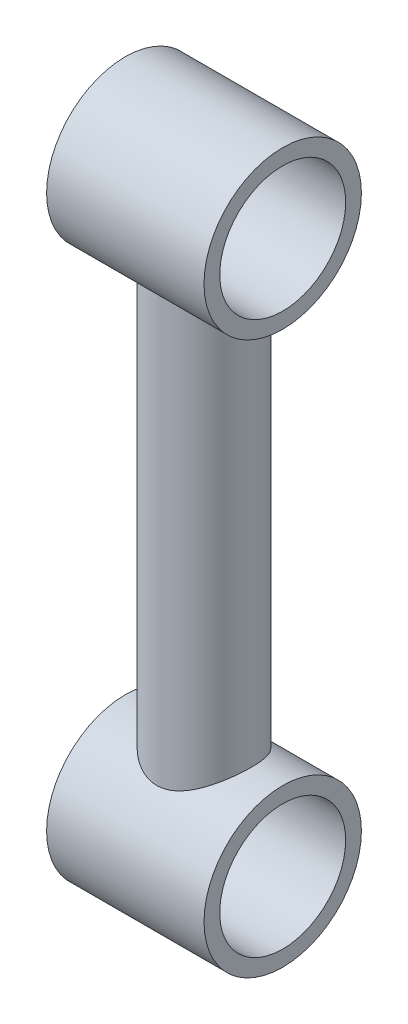
from build123d import *

# Parameters (mm, degrees)
SKETCH_1_R           = 50
SKETCH_1_R_2         = 40
EXTRUDE_1_DEPTH      = 50
EXTRUDE_2_REACH      = 238.327
EXTRUDE_2_END_RADIUS = 50
SKETCH_2_R           = 30


with BuildPart() as part:
    # 草图1 → 凸台-拉伸1 (new, symmetric)
    with BuildSketch(Plane(origin=(0, 0, 0), x_dir=(0, 0, -1), z_dir=(1, 0, 0))):
        Circle(SKETCH_1_R)
        Circle(SKETCH_1_R_2, mode=Mode.SUBTRACT)
    extrude_1 = extrude(amount=EXTRUDE_1_DEPTH, both=True)

    # 凸台-拉伸2: up to this cylinder (the profile starts outside it)
    extrude_2_end = Plane(origin=(0, 0, 0), z_dir=(-1, 0, 0)) * Cylinder(EXTRUDE_2_END_RADIUS, 577.654, mode=Mode.PRIVATE)
    # 草图2 → 凸台-拉伸2 (add, up to the surface)
    with BuildSketch(Plane(origin=(0, 175.5, 0), x_dir=(1, 0, 0), z_dir=(0, 1, 0)), mode=Mode.PRIVATE) as extrude_2_sk1:
        with Locations(Location((0, 0, 0), (0, 0, 270))):
            Circle(SKETCH_2_R)
    extrude_2_tool1 = extrude(extrude_2_sk1.sketch, amount=-EXTRUDE_2_REACH, mode=Mode.PRIVATE) - extrude_2_end
    extrude_2 = extrude_2_tool1.solids().sort_by_distance((0, 175.5, 0))[0]
    add(extrude_2)

    # 镜向2: 凸台-拉伸1, 凸台-拉伸2 across plane
    add(extrude_1.mirror(Plane.ZX.offset(175.5)))
    add(extrude_2.mirror(Plane.ZX.offset(175.5)))


solid = part.part
